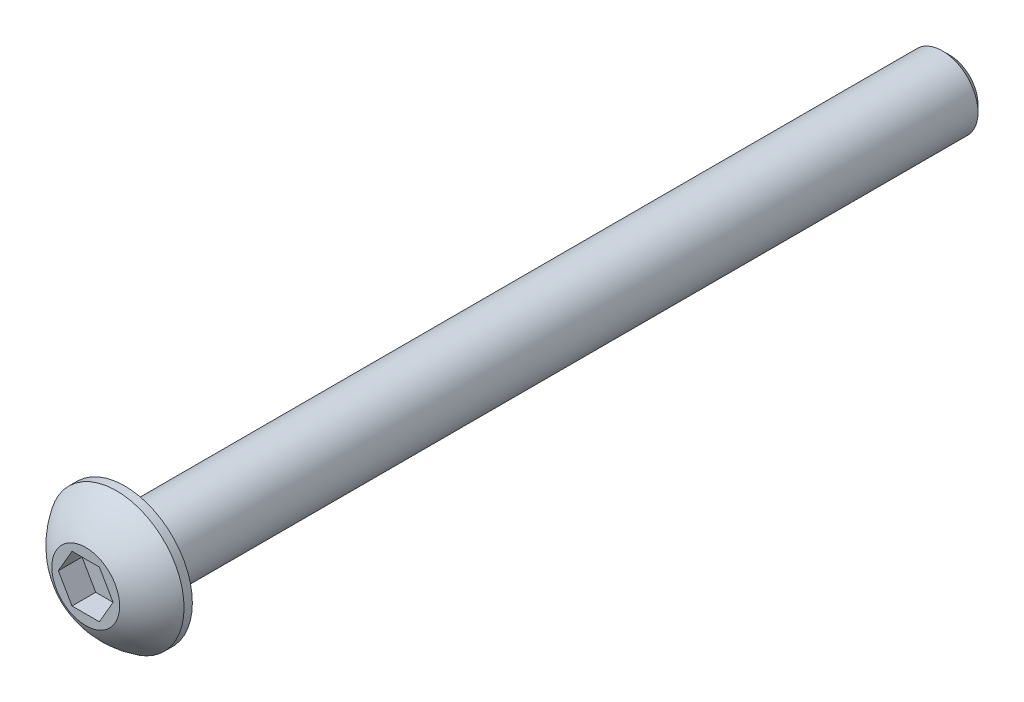
from build123d import *

# Parameters (mm, degrees)
CUT_EXTRUDE_1_DEPTH = 1
CHAMFER_2_SIZE      = 0.3


with BuildPart() as part:
    # 草图1 → 旋转1 (revolve)
    with BuildSketch(Plane(origin=(0, 0, 0), x_dir=(0, 0, -1), z_dir=(1, 0, 0)), mode=Mode.PRIVATE) as revolve_1_sk:
        with BuildLine():
            Line((0, 1.5), (0, 2.85))
            Line((0, 2.85), (-0.35, 2.85))
            ThreePointArc((-0.35, 2.85), (-1.098097646, 2.229807704), (-1.65, 1.43))
            Line((-1.65, 1.43), (-1.65, 0))
            Line((-1.65, 0), (0, 0))
            Line((0, 0), (34.8, 0))
            Line((34.8, 0), (34.8, 1.5))
            Line((34.8, 1.5), (0, 1.5))
        make_face()
    revolve(revolve_1_sk.sketch.rotate(Axis((0, 0, 0), (0, 0, -1)), 90), axis=Axis((0, 0, 0), (0, 0, -1)))

    # 草图2 → 切除-拉伸1 (cut)
    with BuildSketch(Plane.XY.offset(1.65)):
        Polygon((-0.577350269, 1), (-1.154700538, 0), (-0.577350269, -1), (0.577350269, -1), (1.154700538, 0), (0.577350269, 1), align=None)
    extrude(amount=-CUT_EXTRUDE_1_DEPTH, mode=Mode.SUBTRACT)

    # 倒角2
    chamfer_2_edges = [part.edges().sort_by_distance(p)[0] for p in [
        (-1.5, 0, -34.8),
    ]]
    chamfer(chamfer_2_edges, length=CHAMFER_2_SIZE)


solid = part.part
